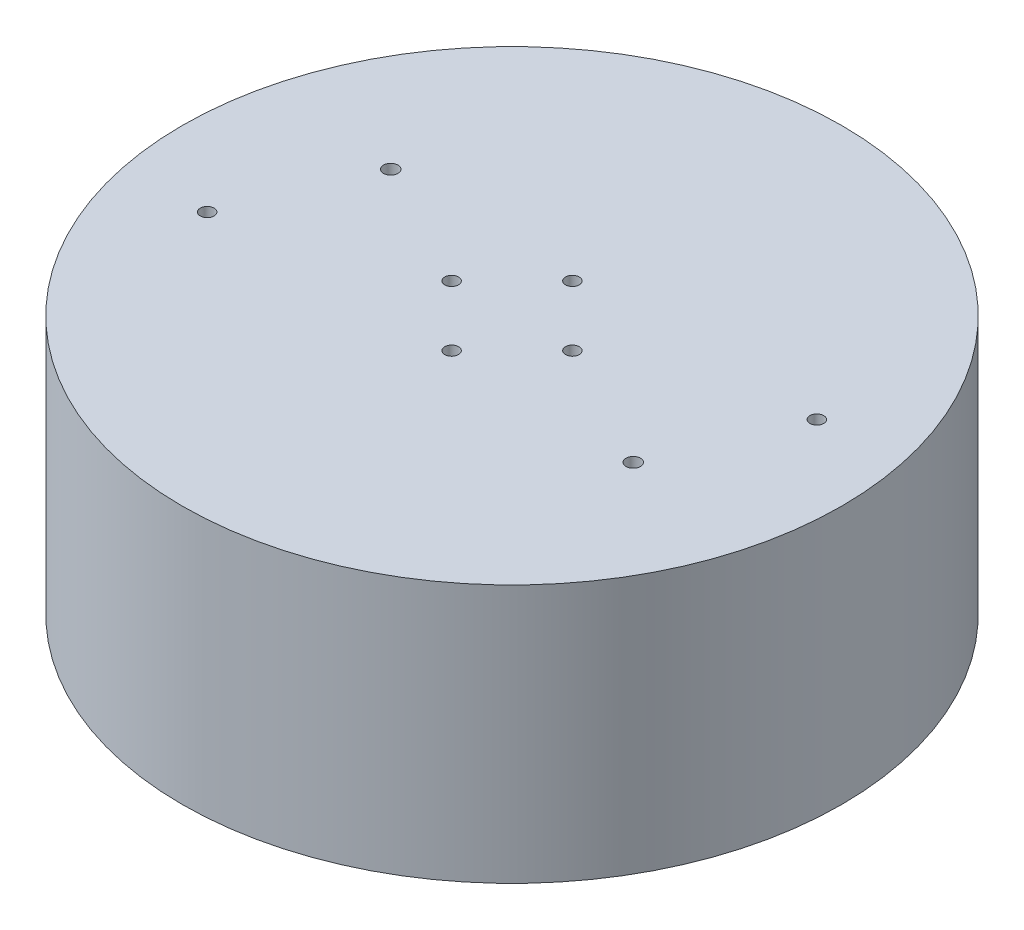
from build123d import *

# Parameters (mm, degrees)
SKETCH1_R           = 68.25
SKETCH1_R_2         = 58.39180804
BOSS_EXTRUDE1_DEPTH = 5
SKETCH2_R           = 68.25
SKETCH2_R_2         = 66.25
BOSS_EXTRUDE2_DEPTH = 46
CUT_EXTRUDE2_DEPTH  = 107.921115782
CIRPATTERN1_COUNT   = 40
SKETCH6_R           = 60.254557181
CUT_EXTRUDE4_DEPTH  = 107.921115782
SKETCH3_R           = 68.25
BOSS_EXTRUDE3_DEPTH = 2.5
SKETCH4_R           = 1.425
CUT_EXTRUDE1_DEPTH  = 111.355674979
SKETCH7_R           = 1.425
SKETCH7_R_2         = 1.5
CUT_EXTRUDE5_DEPTH  = 3.18
SKETCH8_R           = 1.425
SKETCH8_R_2         = 1.5
CUT_EXTRUDE6_DEPTH  = 3.18


with BuildPart() as part:
    # Sketch1 → Boss-Extrude1 (new body)
    with BuildSketch(Plane(origin=(0, 0, 0), x_dir=(1, 0, 0), z_dir=(0, 1, 0))):
        with Locations(Location((0, 0, 0), (0, 0, 270))):
            Circle(SKETCH1_R)
        with Locations(Location((0, 0, 0), (0, 0, 270))):
            Circle(SKETCH1_R_2, mode=Mode.SUBTRACT)
    extrude(amount=BOSS_EXTRUDE1_DEPTH)

    # Sketch2 → Boss-Extrude2 (add)
    with BuildSketch(Plane(origin=(0, 5, 0), x_dir=(1, 0, 0), z_dir=(0, 1, 0))):
        with Locations(Location((0, 0, 0), (0, 0, 270))):
            Circle(SKETCH2_R)
        with Locations(Location((0, 0, 0), (0, 0, 270))):
            Circle(SKETCH2_R_2, mode=Mode.SUBTRACT)
    extrude(amount=BOSS_EXTRUDE2_DEPTH)

    # Sketch5 → Cut-Extrude2 (cut, through all)
    with BuildSketch(Plane(origin=(0, 5, 0), x_dir=(1, 0, 0), z_dir=(0, 1, 0))):
        with BuildLine():
            ThreePointArc((60.912850331, -1.733081317), (60.9375, 0), (60.912850331, 1.733081317))
            ThreePointArc((60.912850331, 1.733081317), (62.464959619, 1.96900991), (64, 2.298185506))
            ThreePointArc((64, 2.298185506), (61.895611564, 2.911528798), (59.850363948, 3.699946756))
            ThreePointArc((59.850363948, 3.699946756), (59.75, 0), (59.850363948, -3.699946756))
            ThreePointArc((59.850363948, -3.699946756), (61.895611564, -2.911528798), (64, -2.298185506))
            ThreePointArc((64, -2.298185506), (62.464959619, -1.96900991), (60.912850331, -1.733081317))
        make_face()
        with BuildLine():
            ThreePointArc((64, 2.298185506), (62.464959619, 1.96900991), (60.912850331, 1.733081317))
            ThreePointArc((60.912850331, 1.733081317), (60.9375, 0), (60.912850331, -1.733081317))
            ThreePointArc((60.912850331, -1.733081317), (62.464959619, -1.96900991), (64, -2.298185506))
            ThreePointArc((64, -2.298185506), (65.10718497, -2.051039477), (66.224096959, -1.852425968))
            ThreePointArc((66.224096959, -1.852425968), (66.243523923, -0.926303532), (66.25, 0))
            ThreePointArc((66.25, 0), (66.243523923, 0.926303532), (66.224096959, 1.852425968))
            ThreePointArc((66.224096959, 1.852425968), (65.10718497, 2.051039477), (64, 2.298185506))
        make_face()
        with BuildLine():
            ThreePointArc((67.087149669, 1.733081317), (66.655123371, 1.789138255), (66.224096959, 1.852425968))
            ThreePointArc((66.224096959, 1.852425968), (66.243523923, 0.926303532), (66.25, 0))
            ThreePointArc((66.25, 0), (66.243523923, -0.926303532), (66.224096959, -1.852425968))
            ThreePointArc((66.224096959, -1.852425968), (66.655123371, -1.789138255), (67.087149669, -1.733081317))
            ThreePointArc((67.087149669, -1.733081317), (67.0625, 0), (67.087149669, 1.733081317))
        make_face()
    cut_extrude2 = extrude(amount=-CUT_EXTRUDE2_DEPTH, mode=Mode.SUBTRACT)

    # CirPattern1: Cut-Extrude2 ×40 about axis
    cirpattern1_axis = Axis((0, 0, 0), (0, 1, 0))
    for i in range(1, CIRPATTERN1_COUNT):
        add(cut_extrude2.rotate(cirpattern1_axis, i * 360 / CIRPATTERN1_COUNT), mode=Mode.SUBTRACT)

    # Sketch6 → Cut-Extrude4 (cut, through all)
    with BuildSketch(Plane(origin=(0, 5, 0), x_dir=(1, 0, 0), z_dir=(0, 1, 0))):
        Circle(SKETCH6_R)
    extrude(amount=-CUT_EXTRUDE4_DEPTH, mode=Mode.SUBTRACT)

    # Sketch3 → Boss-Extrude3 (add)
    with BuildSketch(Plane(origin=(0, 51, 0), x_dir=(1, 0, 0), z_dir=(0, 1, 0))):
        with Locations(Location((0, 0, 0), (0, 0, 270))):
            Circle(SKETCH3_R)
    extrude(amount=BOSS_EXTRUDE3_DEPTH)

    # Sketch4 → Cut-Extrude1 (cut, through all)
    with BuildSketch(Plane(origin=(0, 53.5, 0), x_dir=(1, 0, 0), z_dir=(0, 1, 0))):
        with Locations(Location((0, 12.5, 0), (0, 0, 270))):
            Circle(SKETCH4_R)
        with Locations(Location((-12.5, 0, 0), (0, 0, 270))):
            Circle(SKETCH4_R)
        with Locations(Location((0, -12.5, 0), (0, 0, 270))):
            Circle(SKETCH4_R)
        with Locations(Location((12.5, 0, 0), (0, 0, 270))):
            Circle(SKETCH4_R)
    extrude(amount=-CUT_EXTRUDE1_DEPTH, mode=Mode.SUBTRACT)

    # Sketch7 → Cut-Extrude5 (cut)
    with BuildSketch(Plane(origin=(0, 53.5, 0), x_dir=(1, 0, 0), z_dir=(0, 1, 0))):
        with Locations(Location((-50.147752056, -12.951582799, 0), (0, 0, 270))):
            Circle(SKETCH7_R)
        with Locations(Location((-38.82806539, 13.716592104, 0), (0, 0, 270))):
            Circle(SKETCH7_R_2)
    extrude(amount=-CUT_EXTRUDE5_DEPTH, mode=Mode.SUBTRACT)

    # Sketch8 → Cut-Extrude6 (cut)
    with BuildSketch(Plane(origin=(0, 53.5, 0), x_dir=(1, 0, 0), z_dir=(0, 1, 0))):
        with Locations(Location((50.147752056, 12.951582799, 0), (0, 0, 270))):
            Circle(SKETCH8_R)
        with Locations(Location((38.82806539, -13.716592104, 0), (0, 0, 270))):
            Circle(SKETCH8_R_2)
    extrude(amount=-CUT_EXTRUDE6_DEPTH, mode=Mode.SUBTRACT)


solid = part.part
